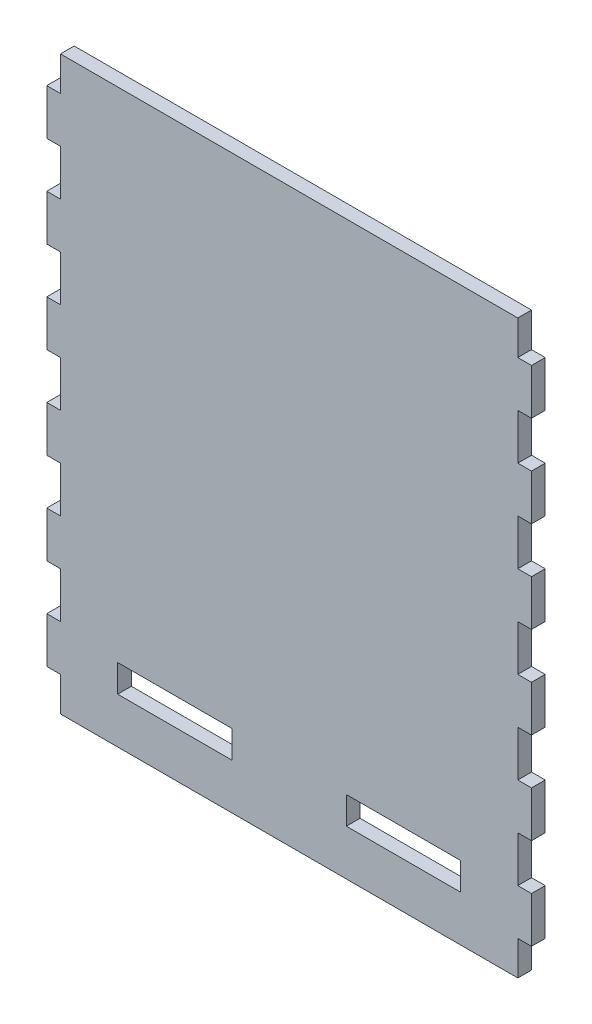
from build123d import *

# Parameters (mm, degrees)
SKETCH_1_W      = 50
SKETCH_1_H      = 12
EXTRUDE_1_DEPTH = 6


with BuildPart() as part:
    # 草图1 → 凸台-拉伸1 (new body)
    with BuildSketch(Plane.XY):
        Polygon((-118.430922138, 110.033611019), (-118.430922138, 90.033611019), (-124.430922138, 90.033611019), (-124.430922138, 70.033611019), (-118.430922138, 70.033611019), (-118.430922138, 50.033611019), (-124.430922138, 50.033611019), (-124.430922138, 30.033611019), (-118.430922138, 30.033611019), (-118.430922138, 10.033611019), (-124.430922138, 10.033611019), (-124.430922138, -9.966388981), (-118.430922138, -9.966388981), (-118.430922138, -29.966388981), (-124.430922138, -29.966388981), (-124.430922138, -49.966388981), (-118.430922138, -49.966388981), (-118.430922138, -69.966388981), (-124.430922138, -69.966388981), (-124.430922138, -89.966388981), (-118.430922138, -89.966388981), (-118.430922138, -104.966388981), (81.569077862, -104.966388981), (81.569077862, -89.966388981), (87.569077862, -89.966388981), (87.569077862, -69.966388981), (81.569077862, -69.966388981), (81.569077862, -49.966388981), (87.569077862, -49.966388981), (87.569077862, -29.966388981), (81.569077862, -29.966388981), (81.569077862, -9.966388981), (87.569077862, -9.966388981), (87.569077862, 10.033611019), (81.569077862, 10.033611019), (81.569077862, 30.033611019), (87.569077862, 30.033611019), (87.569077862, 50.033611019), (81.569077862, 50.033611019), (81.569077862, 70.033611019), (87.569077862, 70.033611019), (87.569077862, 90.033611019), (81.569077862, 90.033611019), (81.569077862, 110.033611019), (87.569077862, 110.033611019), (87.569077862, 130.033611019), (81.569077862, 130.033611019), (81.569077862, 145.033611019), (-118.430922138, 145.033611019), (-118.430922138, 130.033611019), (-124.430922138, 130.033611019), (-124.430922138, 110.033611019), align=None)
        with Locations((-68.430922138, -78.966388981)):
            Rectangle(SKETCH_1_W, SKETCH_1_H, mode=Mode.SUBTRACT)
        with Locations((31.569077862, -78.966388981)):
            Rectangle(SKETCH_1_W, SKETCH_1_H, mode=Mode.SUBTRACT)
    extrude(amount=EXTRUDE_1_DEPTH)


solid = part.part
